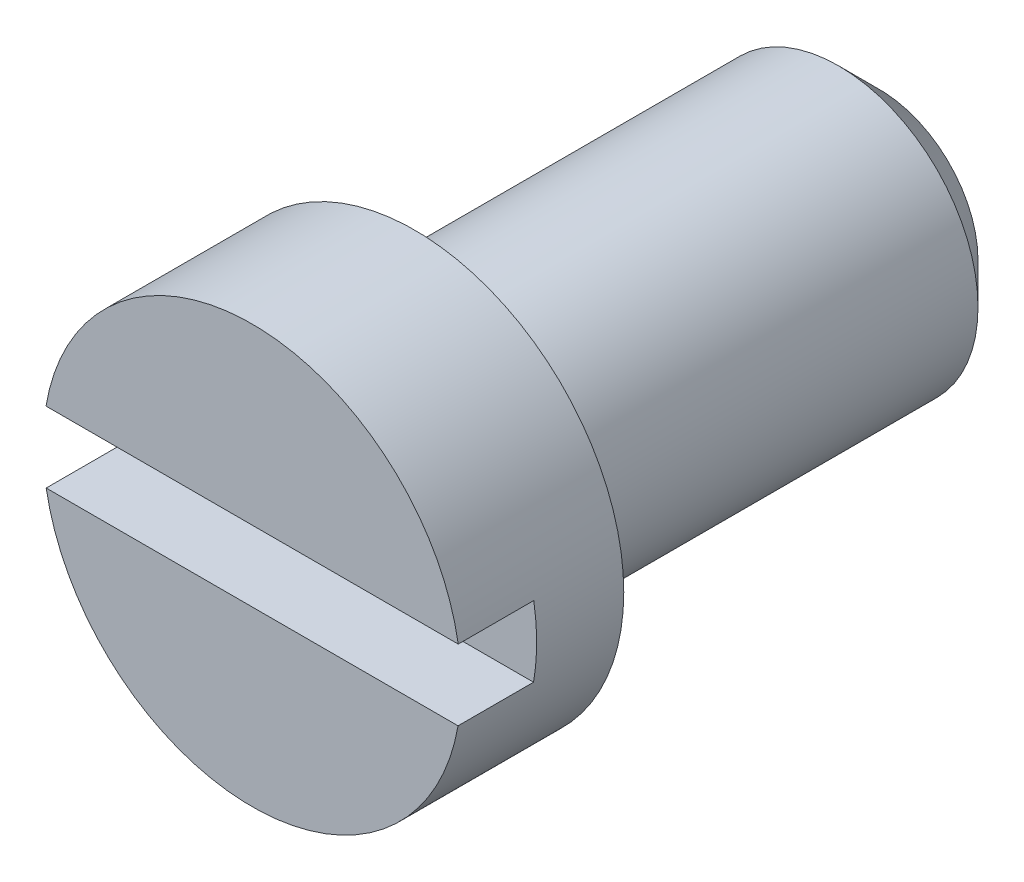
from build123d import *

# Parameters (mm, degrees)
SKETCH_12_R         = 9
EXTRUDE_3_DEPTH     = 7
SKETCH_13_R         = 6
EXTRUDE_4_DEPTH     = 20
SKETCH_20_W         = 19.196078431
SKETCH_20_H         = 3.05
CUT_EXTRUDE_8_DEPTH = 3.25
CHAMFER_1_SIZE      = 1.75


with BuildPart() as part:
    # Эскиз12 → Вытянуть3 (new body)
    with BuildSketch(Plane.XY):
        Circle(SKETCH_12_R)
    extrude(amount=EXTRUDE_3_DEPTH)

    # Эскиз13 → Вытянуть4 (add)
    with BuildSketch(Plane(origin=(0, 0, 0), x_dir=(-1, 0, 0), z_dir=(0, 0, -1))):
        with Locations(Location((0, 0, 0), (0, 0, 180))):
            Circle(SKETCH_13_R)
    extrude(amount=EXTRUDE_4_DEPTH)

    # Эскиз20 → Вырез-Вытянуть8 (cut)
    with BuildSketch(Plane.XY.offset(7)):
        with Locations((0.046218488, -0.025)):
            Rectangle(SKETCH_20_W, SKETCH_20_H)
    extrude(amount=-CUT_EXTRUDE_8_DEPTH, mode=Mode.SUBTRACT)

    # Фаска1
    chamfer_1_edges = [part.edges().sort_by_distance(p)[0] for p in [
        (-6, 0, -20),
    ]]
    chamfer(chamfer_1_edges, length=CHAMFER_1_SIZE)


solid = part.part
